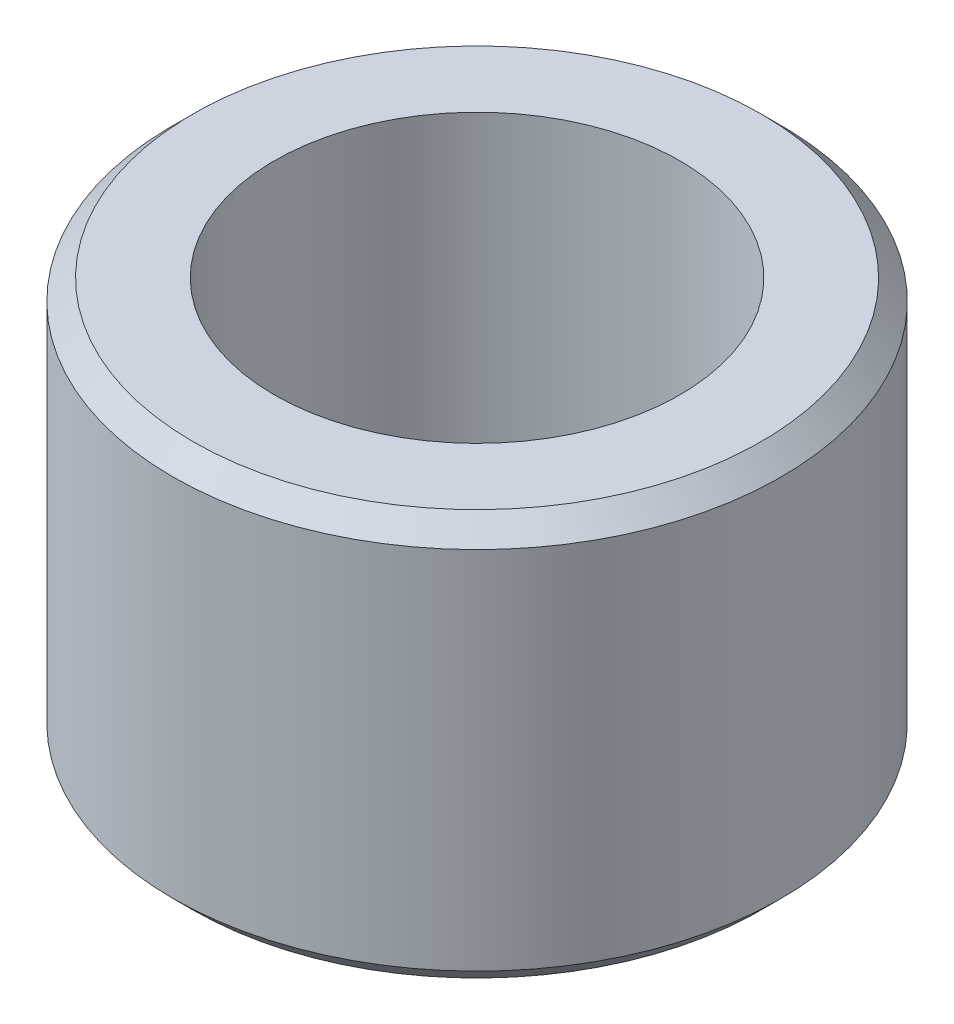
from build123d import *

# Parameters (mm, degrees)
SKETCH1_R           = 15
SKETCH1_R_2         = 10
BOSS_EXTRUDE1_DEPTH = 20
CHAMFER1_SIZE       = 1


with BuildPart() as part:
    # Sketch1 → Boss-Extrude1 (new body)
    with BuildSketch(Plane(origin=(0, 0, 0), x_dir=(1, 0, 0), z_dir=(0, 1, 0))):
        with Locations(Location((0, 0, 0), (0, 0, 270))):
            Circle(SKETCH1_R)
        with Locations(Location((0, 0, 0), (0, 0, 270))):
            Circle(SKETCH1_R_2, mode=Mode.SUBTRACT)
    extrude(amount=BOSS_EXTRUDE1_DEPTH)

    # Chamfer1
    chamfer1_edges = [part.edges().sort_by_distance(p)[0] for p in [
        (0, 0, -15),
        (0, 20, -15),
    ]]
    chamfer(chamfer1_edges, length=CHAMFER1_SIZE)


solid = part.part
